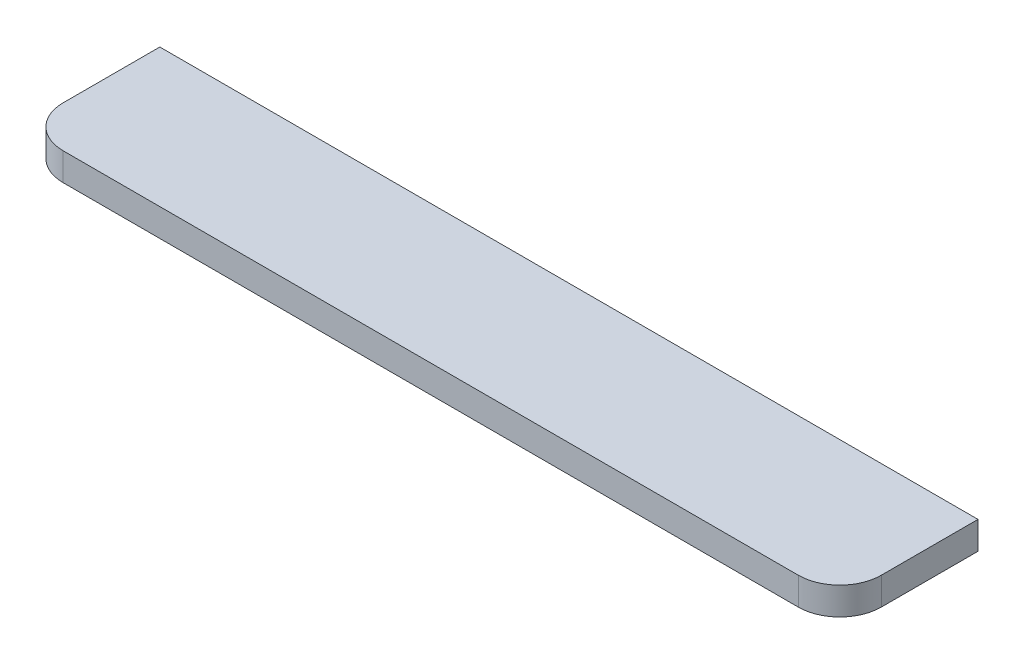
from build123d import *

# Parameters (mm, degrees)
BOSS_EXTRUDE1_DEPTH = 10


with BuildPart() as part:
    # Sketch1 → Boss-Extrude1 (new body)
    with BuildSketch(Plane(origin=(0, 0, 0), x_dir=(1, 0, 0), z_dir=(0, 1, 0))):
        with BuildLine():
            Line((-148, 25), (148, 25))
            Line((148, 25), (148, -10))
            ThreePointArc((148, -10), (143.606601718, -20.606601718), (133, -25))
            Line((133, -25), (-133, -25))
            ThreePointArc((-133, -25), (-143.606601718, -20.606601718), (-148, -10))
            Line((-148, -10), (-148, 25))
        make_face()
    extrude(amount=BOSS_EXTRUDE1_DEPTH)


solid = part.part
